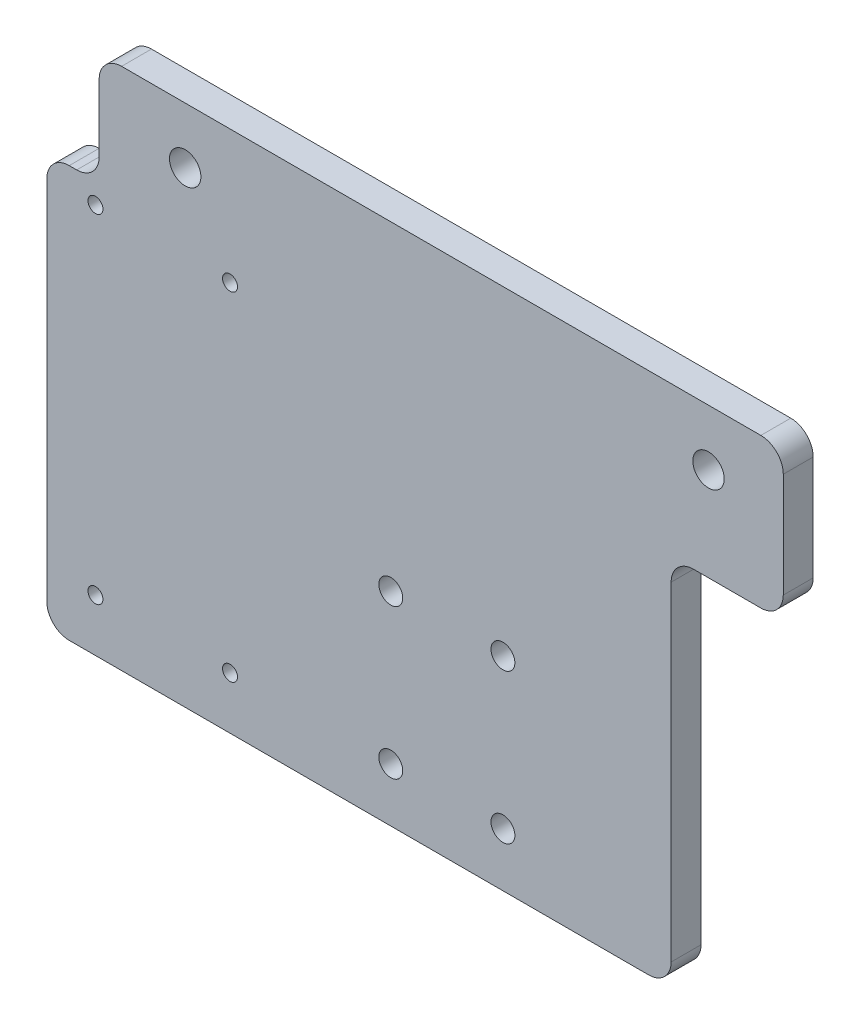
from build123d import *

# Parameters (mm, degrees)
SKETCH_1_W          = 250
SKETCH_1_H          = 30
SKETCH_1_R          = 1.5
EXTRUDE_1_DEPTH     = 4
SKETCH_2_R          = 3
CUT_EXTRUDE_1_DEPTH = 126.96031121
SKETCH_3_W          = 250
SKETCH_3_H          = 70
SKETCH_3_R          = 1.5
SKETCH_3_R_2        = 2.1
EXTRUDE_2_DEPTH     = 4
CUT_EXTRUDE_2_DEPTH = 152.215078613
FILLET_1_R          = 5
SKETCH_5_R          = 3
CUT_EXTRUDE_3_DEPTH = 152.215078613
SKETCH_8_W          = 20
SKETCH_8_H          = 50
EXTRUDE_4_DEPTH     = 4
SKETCH_9_R          = 1
CUT_EXTRUDE_4_DEPTH = 10
SKETCH_10_W         = 35
SKETCH_10_H         = 30
CUT_EXTRUDE_5_DEPTH = 10
SKETCH_11_W         = 70
SKETCH_11_H         = 4.604086331
EXTRUDE_5_DEPTH     = 4
FILLET_4_R          = 10
CUT_EXTRUDE_6_DEPTH = 10
SKETCH_14_W         = 11.507162467
SKETCH_14_H         = 5
EXTRUDE_6_DEPTH     = 4
SKETCH_15_W         = 3
SKETCH_15_H         = 55
SKETCH_15_W_2       = 15
SKETCH_15_H_2       = 50
CUT_EXTRUDE_7_DEPTH = 10
FILLET_6_R          = 3
SKETCH_16_R         = 1.6
CUT_EXTRUDE_8_DEPTH = 10
CHAMFER_2_SIZE      = 1


with BuildPart() as part:
    # 草图1 → 凸台-拉伸1 (new body)
    with BuildSketch(Plane.XY):
        Rectangle(SKETCH_1_W, SKETCH_1_H)
        with Locations((-115, -10)):
            Circle(SKETCH_1_R, mode=Mode.SUBTRACT)
        with Locations((-115, 10)):
            Circle(SKETCH_1_R, mode=Mode.SUBTRACT)
        with Locations(Location((115, 10, 0), (0, 0, 180))):
            Circle(SKETCH_1_R, mode=Mode.SUBTRACT)
        with Locations(Location((115, -10, 0), (0, 0, 180))):
            Circle(SKETCH_1_R, mode=Mode.SUBTRACT)
    extrude(amount=EXTRUDE_1_DEPTH)

    # 草图2 → 切除-拉伸1 (cut, through all)
    with BuildSketch(Plane.XY.offset(4)):
        with Locations((-23, 2.5)):
            Circle(SKETCH_2_R)
        with Locations((23, 2.5)):
            Circle(SKETCH_2_R)
        with Locations((23, 15.5)):
            Circle(SKETCH_2_R)
        with Locations((-23, 15.5)):
            Circle(SKETCH_2_R)
    extrude(amount=-CUT_EXTRUDE_1_DEPTH, mode=Mode.SUBTRACT)

    # 草图3 → 凸台-拉伸2 (add)
    with BuildSketch(Plane.XY.offset(4)):
        with Locations((0, 50)):
            Rectangle(SKETCH_3_W, SKETCH_3_H)
        with Locations((-115, 30)):
            Circle(SKETCH_3_R, mode=Mode.SUBTRACT)
        with Locations((-115, 50)):
            Circle(SKETCH_3_R, mode=Mode.SUBTRACT)
        with Locations((-115, 70)):
            Circle(SKETCH_3_R, mode=Mode.SUBTRACT)
        with Locations((115, 30)):
            Circle(SKETCH_3_R, mode=Mode.SUBTRACT)
        with Locations((115, 50)):
            Circle(SKETCH_3_R, mode=Mode.SUBTRACT)
        with Locations((115, 70)):
            Circle(SKETCH_3_R, mode=Mode.SUBTRACT)
        with Locations((-35, 77.5)):
            Circle(SKETCH_3_R_2, mode=Mode.SUBTRACT)
        with Locations((35, 77.5)):
            Circle(SKETCH_3_R_2, mode=Mode.SUBTRACT)
    extrude(amount=-EXTRUDE_2_DEPTH)

    # 草图4 → 切除-拉伸2 (cut, through all)
    with BuildSketch(Plane.XY.offset(4)):
        with BuildLine():
            Line((-97, 70), (-48, 70))
            ThreePointArc((-48, 70), (-45.878679656, 69.121320344), (-45, 67))
            Line((-45, 67), (-45, 3))
            ThreePointArc((-45, 3), (-45.878679656, 0.878679656), (-48, 0))
            Line((-48, 0), (-97, 0))
            ThreePointArc((-97, 0), (-99.121320344, 0.878679656), (-100, 3))
            Line((-100, 3), (-100, 67))
            ThreePointArc((-100, 67), (-99.121320344, 69.121320344), (-97, 70))
        make_face()
        with BuildLine():
            Line((97, 0), (48, 0))
            ThreePointArc((48, 0), (45.878679656, 0.878679656), (45, 3))
            Line((45, 3), (45, 67))
            ThreePointArc((45, 67), (45.878679656, 69.121320344), (48, 70))
            Line((48, 70), (97, 70))
            ThreePointArc((97, 70), (99.121320344, 69.121320344), (100, 67))
            Line((100, 67), (100, 3))
            ThreePointArc((100, 3), (99.121320344, 0.878679656), (97, 0))
        make_face()
    extrude(amount=-CUT_EXTRUDE_2_DEPTH, mode=Mode.SUBTRACT)

    # 圆角1
    fillet_1_edges = [part.edges().sort_by_distance(p)[0] for p in [
        (125, 85, 2),
        (-125, 85, 2),
        (125, -15, 2),
        (-125, -15, 2),
    ]]
    fillet(fillet_1_edges, radius=FILLET_1_R)

    # 草图5 → 切除-拉伸3 (cut, through all)
    with BuildSketch(Plane.XY.offset(4)):
        with Locations((-23, 15.5)):
            Circle(SKETCH_5_R)
        with Locations((23, 15.5)):
            Circle(SKETCH_5_R)
    extrude(amount=-CUT_EXTRUDE_3_DEPTH, mode=Mode.SUBTRACT)

    # 草图8 → 凸台-拉伸4 (add)
    with BuildSketch(Plane.XY.offset(4)):
        with Locations((-55, 45)):
            Rectangle(SKETCH_8_W, SKETCH_8_H)
    extrude(amount=-EXTRUDE_4_DEPTH)

    # 草图9 → 切除-拉伸4 (cut)
    with BuildSketch(Plane.XY.offset(4)):
        with Locations((-47, 22)):
            Circle(SKETCH_9_R)
        with Locations((-29, 22)):
            Circle(SKETCH_9_R)
        with Locations((-47, 67.2)):
            Circle(SKETCH_9_R)
        with Locations((-29, 67.2)):
            Circle(SKETCH_9_R)
    extrude(amount=-CUT_EXTRUDE_4_DEPTH, mode=Mode.SUBTRACT)

    # 草图10 → 切除-拉伸5 (cut)
    with BuildSketch(Plane.XY.offset(4)):
        with Locations((-17.5, 0)):
            Rectangle(SKETCH_10_W, SKETCH_10_H)
        with Locations((17.5, 0)):
            Rectangle(SKETCH_10_W, SKETCH_10_H)
    extrude(amount=-CUT_EXTRUDE_5_DEPTH, mode=Mode.SUBTRACT)

    # 草图11 → 凸台-拉伸5 (add)
    with BuildSketch(Plane.XY.offset(4)):
        with Locations((0, 17.302043166)):
            Rectangle(SKETCH_11_W, SKETCH_11_H)
    extrude(amount=-EXTRUDE_5_DEPTH)

    # 圆角4
    fillet_4_edges = [part.edges().sort_by_distance(p)[0] for p in [
        (-35, -15, 2),
        (35, -15, 2),
        (35, 15, 2),
        (-35, 15, 2),
    ]]
    fillet(fillet_4_edges, radius=FILLET_4_R)

    # 草图12 → 切除-拉伸6 (cut)
    with BuildSketch(Plane.XY.offset(4)):
        Polygon((-159.482057717, 67), (-159.482057717, -21.443198138), (-25, -21.443198138), (-25, 15), (-56.507162467, 15), (-56.507162467, 102.331531395), (-144.590660761, 102.331531395), (-144.590660761, 67), align=None)
        Polygon((45, 102.331531395), (45, 15), (25, 15), (25, -21.443198138), (159.482057717, -21.443198138), (159.482057717, 67), (144.590660761, 67), (144.590660761, 102.331531395), align=None)
    extrude(amount=-CUT_EXTRUDE_6_DEPTH, mode=Mode.SUBTRACT)

    # 草图14 → 凸台-拉伸6 (add)
    with BuildSketch(Plane.XY.offset(4)):
        with Locations((-50.753581234, 17.5)):
            Rectangle(SKETCH_14_W, SKETCH_14_H)
    extrude(amount=-EXTRUDE_6_DEPTH)

    # 草图15 → 切除-拉伸7 (cut)
    with BuildSketch(Plane.XY.offset(4)):
        Polygon((-56.507162467, 70), (-53.507162467, 70), (-46.507162467, 70), (-46.507162467, 85), (-56.507162467, 85), align=None)
        with Locations((-55.007162467, 42.5)):
            Rectangle(SKETCH_15_W, SKETCH_15_H)
        with Locations((37.5, 40)):
            Rectangle(SKETCH_15_W_2, SKETCH_15_H_2)
    extrude(amount=-CUT_EXTRUDE_7_DEPTH, mode=Mode.SUBTRACT)

    # 圆角6
    fillet_6_edges = [part.edges().sort_by_distance(p)[0] for p in [
        (45, 85, 2),
        (30, 15, 2),
        (-46.507162467, 70, 2),
        (-46.507162467, 85, 2),
        (-53.507162467, 70, 2),
        (-53.507162467, 15, 2),
        (30, 65, 2),
        (45, 65, 2),
    ]]
    fillet(fillet_6_edges, radius=FILLET_6_R)

    # 草图16 → 切除-拉伸8 (cut)
    with BuildSketch(Plane.XY.offset(4)):
        with Locations((-7.5, 42.2)):
            Circle(SKETCH_16_R)
        with Locations((7.5, 42.2)):
            Circle(SKETCH_16_R)
        with Locations((-7.5, 22.2)):
            Circle(SKETCH_16_R)
        with Locations((7.5, 22.2)):
            Circle(SKETCH_16_R)
    extrude(amount=-CUT_EXTRUDE_8_DEPTH, mode=Mode.SUBTRACT)

    # 倒角2
    chamfer_2_edges = [part.edges().sort_by_distance(p)[0] for p in [
        (-9.1, 42.2, 0),
    ]]
    chamfer(chamfer_2_edges, length=CHAMFER_2_SIZE)


solid = part.part
